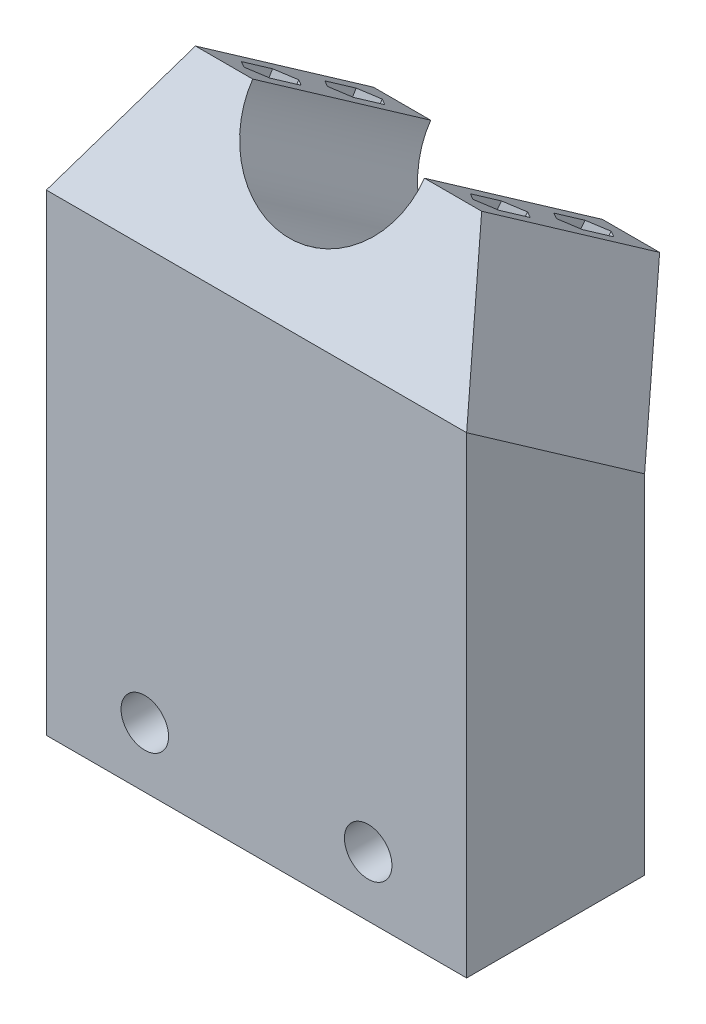
from build123d import *

# Parameters (mm, degrees)
CROQUIS1_W              = 44.053125
CROQUIS1_H              = 36.438869972
CROQUIS1_R              = 2.4892
SALIENTE_EXTRUIR1_DEPTH = 18.653125
SALIENTE_EXTRUIR2_DEPTH = 44.053125
SALIENTE_EXTRUIR3_DEPTH = 22.771261


with BuildPart() as part:
    # Croquis1 → Saliente-Extruir1 (new body)
    with BuildSketch(Plane.XY):
        with Locations((22.0265625, 18.219434986)):
            Rectangle(CROQUIS1_W, CROQUIS1_H)
        with Locations((10.31875, 6.2992)):
            Circle(CROQUIS1_R, mode=Mode.SUBTRACT)
        with Locations(Location((33.734375, 6.2992, 0), (0, 0, 180))):
            Circle(CROQUIS1_R, mode=Mode.SUBTRACT)
    extrude(amount=SALIENTE_EXTRUIR1_DEPTH)

    # Croquis3 → Saliente-Extruir2 (add)
    with BuildSketch(Plane.ZY):
        Polygon((0, 36.438869972), (18.653125, 49.499928708), (18.653125, 36.438869972), align=None)
    extrude(amount=-SALIENTE_EXTRUIR2_DEPTH)


with BuildPart() as body_2:
    # Croquis5 → Saliente-Extruir3 (new body)
    with BuildSketch(Plane(origin=(0, 11.988021221, 17.120668611), x_dir=(1, 0, 0), z_dir=(0, 0.5735764363510476, 0.8191520442889909))):
        with BuildLine():
            ThreePointArc((7.0265625, 44.848974829), (11.419960782, 34.242373111), (22.0265625, 29.848974829))
            Line((22.0265625, 29.848974829), (22.0265625, 35.848974829))
            ThreePointArc((22.0265625, 35.848974829), (15.662601469, 38.485013798), (13.0265625, 44.848974829))
            Line((13.0265625, 44.848974829), (7.0265625, 44.848974829))
        make_face()
        with BuildLine():
            Line((22.0265625, 35.848974829), (22.0265625, 29.848974829))
            ThreePointArc((22.0265625, 29.848974829), (32.633164218, 34.242373111), (37.0265625, 44.848974829))
            Line((37.0265625, 44.848974829), (31.0265625, 44.848974829))
            ThreePointArc((31.0265625, 44.848974829), (28.390523531, 38.485013798), (22.0265625, 35.848974829))
        make_face()
        with BuildLine():
            Line((0, 29.848974829), (22.0265625, 29.848974829))
            ThreePointArc((22.0265625, 29.848974829), (11.419960782, 34.242373111), (7.0265625, 44.848974829))
            Line((7.0265625, 44.848974829), (0, 29.848974829))
        make_face()
        with BuildLine():
            ThreePointArc((37.0265625, 44.848974829), (32.633164218, 34.242373111), (22.0265625, 29.848974829))
            Line((22.0265625, 29.848974829), (44.053125, 29.848974829))
            Line((44.053125, 29.848974829), (37.0265625, 44.848974829))
        make_face()
    extrude(amount=SALIENTE_EXTRUIR3_DEPTH)

    # Croquis7 → Cortar-Revolución1 (revolve, cut)
    with BuildSketch(Plane(origin=(0, 36.738129416, -25.724315156), x_dir=(1, 0, 0), z_dir=(0, 0.8191520442889908, -0.5735764363510477))):
        Polygon((8.5265625, -28.940477183), (8.5265625, -24.940477183), (10.0265625, -23.440477183), (11.5265625, -24.940477183), (11.5265625, -28.940477183), (10.0265625, -30.440477183), align=None)
        Polygon((10.0265625, -41.131738184), (8.5265625, -39.631738184), (8.5265625, -35.631738184), (10.0265625, -34.131738184), (11.5265625, -35.631738184), (11.5265625, -39.631738184), align=None)
    revolve(axis=Axis((22.0265625, 61.787209373, 10.049478455), (0, -0.5735764363510466, -0.8191520442889915)), mode=Mode.SUBTRACT)


solid = Compound([part.part, body_2.part])
